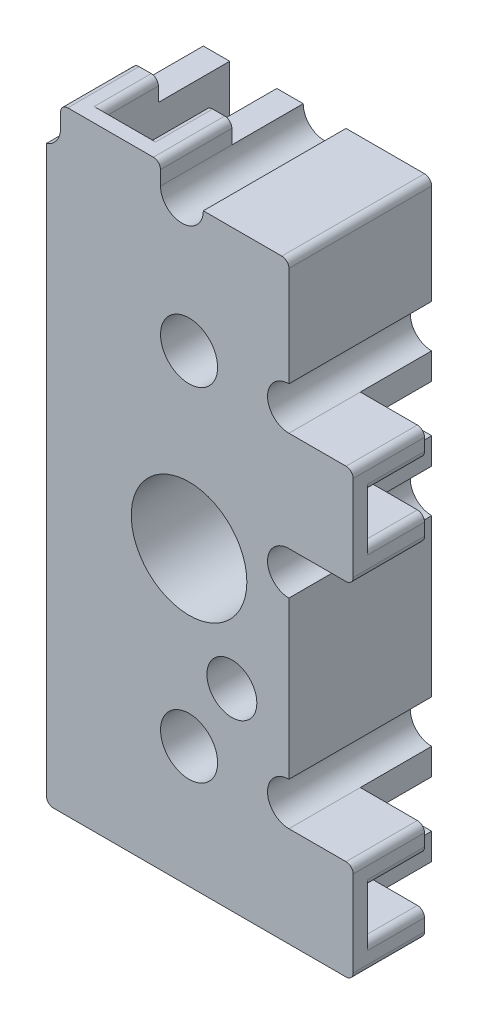
from build123d import *

# Parameters (mm, degrees)
SKETCH12_W          = 17
SKETCH12_H          = 41.5
SKETCH12_R          = 2
SKETCH12_R_2        = 4.05
SKETCH12_R_3        = 1.75
BOSS_EXTRUDE3_DEPTH = 10
SKETCH18_W          = 4.5
SKETCH18_H          = 7
SKETCH18_W_2        = 8
SKETCH18_H_2        = 1.5
BOSS_EXTRUDE4_DEPTH = 5
SKETCH23_R          = 2
CUT_EXTRUDE12_DEPTH = 2
CUT_EXTRUDE13_DEPTH = 46.948340558
CUT_EXTRUDE14_DEPTH = 9
FILLET4_R           = 0.5


with BuildPart() as part:
    # Sketch12 → Boss-Extrude3 (new body)
    with BuildSketch(Plane.XY):
        with Locations((-8.5, -20.75)):
            Rectangle(SKETCH12_W, SKETCH12_H)
        with Locations((-7, -9)):
            Circle(SKETCH12_R, mode=Mode.SUBTRACT)
        with Locations((-7, -21)):
            Circle(SKETCH12_R_2, mode=Mode.SUBTRACT)
        with Locations((-7, -33)):
            Circle(SKETCH12_R, mode=Mode.SUBTRACT)
        with Locations((-4, -28)):
            Circle(SKETCH12_R_3, mode=Mode.SUBTRACT)
    extrude(amount=BOSS_EXTRUDE3_DEPTH)

    # Sketch18 → Boss-Extrude4 (add)
    with BuildSketch(Plane.XY.offset(10)):
        with Locations((2.25, -14)):
            Rectangle(SKETCH18_W, SKETCH18_H)
        with Locations((2.25, -38)):
            Rectangle(SKETCH18_W, SKETCH18_H)
        with Locations((-13, 0.75)):
            Rectangle(SKETCH18_W_2, SKETCH18_H_2)
    extrude(amount=-BOSS_EXTRUDE4_DEPTH)

    # Sketch23 → Cut-Extrude12 (cut)
    with BuildSketch(Plane(origin=(0, 0, 0), x_dir=(-1, 0, 0), z_dir=(0, 0, -1))):
        with Locations((4, -28)):
            Circle(SKETCH23_R)
    extrude(amount=-CUT_EXTRUDE12_DEPTH, mode=Mode.SUBTRACT)

    # Sketch24 → Cut-Extrude13 (cut, through all)
    with BuildSketch(Plane(origin=(0, 0, 0), x_dir=(-1, 0, 0), z_dir=(0, 0, -1))):
        with BuildLine():
            Line((0, -34.5), (-4.5, -34.5))
            ThreePointArc((-4.5, -34.5), (-6, -33), (-4.5, -31.5))
            Line((-4.5, -31.5), (0, -31.5))
            ThreePointArc((0, -31.5), (1.5, -33), (0, -34.5))
        make_face()
        with BuildLine():
            Line((0, -20.5), (-4.5, -20.5))
            ThreePointArc((-4.5, -20.5), (-6, -19), (-4.5, -17.5))
            Line((-4.5, -17.5), (0, -17.5))
            ThreePointArc((0, -17.5), (1.5, -19), (0, -20.5))
        make_face()
        with BuildLine():
            Line((-4.5, -7.5), (0, -7.5))
            ThreePointArc((0, -7.5), (1.5, -9), (0, -10.5))
            Line((0, -10.5), (-4.5, -10.5))
            ThreePointArc((-4.5, -10.5), (-6, -9), (-4.5, -7.5))
        make_face()
        with BuildLine():
            Line((6, 0), (6, 1.5))
            ThreePointArc((6, 1.5), (7.5, 3), (9, 1.5))
            Line((9, 1.5), (9, 0))
            ThreePointArc((9, 0), (7.5, -1.5), (6, 0))
        make_face()
        with BuildLine():
            Line((19, 0), (19, 1.5))
            ThreePointArc((19, 1.5), (17.5, 3), (16, 1.5))
            Line((16, 1.5), (16, 0))
            ThreePointArc((16, 0), (17.5, -1.5), (19, 0))
        make_face()
    extrude(amount=-CUT_EXTRUDE13_DEPTH, mode=Mode.SUBTRACT)

    # Sketch25 → Cut-Extrude14 (cut)
    with BuildSketch(Plane(origin=(0, 0, 0), x_dir=(-1, 0, 0), z_dir=(0, 0, -1))):
        with BuildLine():
            Line((14.15, 1.5), (14.15, -6.35))
            ThreePointArc((14.15, -6.35), (12.5, -8), (10.85, -6.35))
            Line((10.85, -6.35), (10.85, 1.5))
            ThreePointArc((10.85, 1.5), (12.5, 3.15), (14.15, 1.5))
        make_face()
        with BuildLine():
            Line((-4.5, -12.35), (3.35, -12.35))
            ThreePointArc((3.35, -12.35), (5, -14), (3.35, -15.65))
            Line((3.35, -15.65), (-4.5, -15.65))
            ThreePointArc((-4.5, -15.65), (-6.15, -14), (-4.5, -12.35))
        make_face()
        with BuildLine():
            Line((-4.5, -36.35), (3.35, -36.35))
            ThreePointArc((3.35, -36.35), (5, -38), (3.35, -39.65))
            Line((3.35, -39.65), (-4.5, -39.65))
            ThreePointArc((-4.5, -39.65), (-6.15, -38), (-4.5, -36.35))
        make_face()
    extrude(amount=-CUT_EXTRUDE14_DEPTH, mode=Mode.SUBTRACT)

    # Fillet4
    fillet4_edges = [part.edges().sort_by_distance(p)[0] for p in [
        (4.5, -41.5, 7.5),
        (4.5, -10.5, 7.5),
        (4.5, -34.5, 7.5),
        (4.5, -17.5, 7.5),
        (-17, -41.5, 5),
        (0, 0, 5),
        (-9, 1.5, 7.5),
        (-16, 1.5, 7.5),
        (-14.15, 1.5, 7),
        (-10.85, 1.5, 7),
        (4.5, -36.35, 7),
        (4.5, -39.65, 7),
        (4.5, -15.65, 7),
        (4.5, -12.35, 7),
    ]]
    fillet(fillet4_edges, radius=FILLET4_R)


solid = part.part
